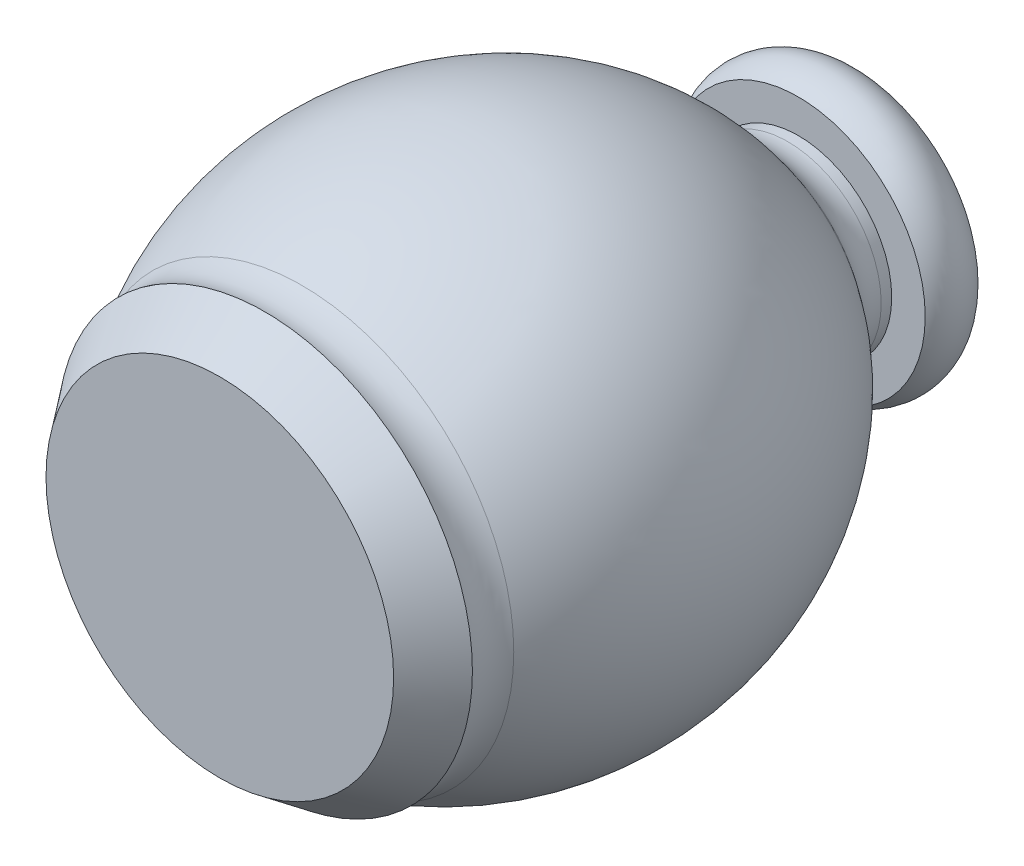
from build123d import *


with BuildPart() as part:
    # Sketch1 → Revolve2 (revolve)
    with BuildSketch(Plane(origin=(0, 0, 0), x_dir=(1, 0, 0), z_dir=(0, 1, 0)), mode=Mode.PRIVATE) as revolve2_sk:
        with BuildLine():
            Line((-30.205060019, 3.210084149), (-27.5885161, 0))
            Line((-27.5885161, 0), (0, 0))
            Line((0, 0), (0, -3))
            Line((0, -3), (-27.676898815, -3))
            Line((-27.676898815, -3), (-33.044109587, 4.179515708))
            ThreePointArc((-33.044109587, 4.179515708), (-32.711440054, 7.215151675), (-33.70285993, 10.103549392))
            ThreePointArc((-33.70285993, 10.103549392), (-40.545605971, 47.560248156), (-20.352013355, 79.840989674))
            Line((-20.352013355, 79.840989674), (-17.684547044, 81.835114975))
            ThreePointArc((-17.684547044, 81.835114975), (-15.617278642, 84.306277282), (-14.875832799, 87.441640077))
            Line((-14.875832799, 87.441640077), (-14.875832799, 89.114758245))
            Line((-14.875832799, 89.114758245), (-20.210312304, 89.114758245))
            ThreePointArc((-20.210312304, 89.114758245), (-21.486375943, 95.197938785), (-17.005982364, 99.506012285))
            Line((-17.005982364, 99.506012285), (-11.875832799, 99.506012285))
            Line((-11.875832799, 99.506012285), (-11.875832799, 96.506012285))
            Line((-11.875832799, 96.506012285), (-16.551156996, 96.506012285))
            ThreePointArc((-16.551156996, 96.506012285), (-18.462910727, 94.725549547), (-18.555747478, 92.114758245))
            Line((-18.555747478, 92.114758245), (-11.875832799, 92.114758245))
            Line((-11.875832799, 92.114758245), (-11.875832799, 87.441640077))
            ThreePointArc((-11.875832799, 87.441640077), (-12.935041145, 82.96255037), (-15.88828172, 79.432318503))
            Line((-15.88828172, 79.432318503), (-18.555748031, 77.438193202))
            ThreePointArc((-18.555748031, 77.438193202), (-37.599115959, 46.996158968), (-31.146131938, 11.67298941))
            ThreePointArc((-31.146131938, 11.67298941), (-29.729817829, 7.546706958), (-30.205060019, 3.210084149))
        make_face()
    revolve(revolve2_sk.sketch.rotate(Axis((0, 0, 0), (0, 0, -1)), 180), axis=Axis((0, 0, 0), (0, 0, -1)))


solid = part.part
